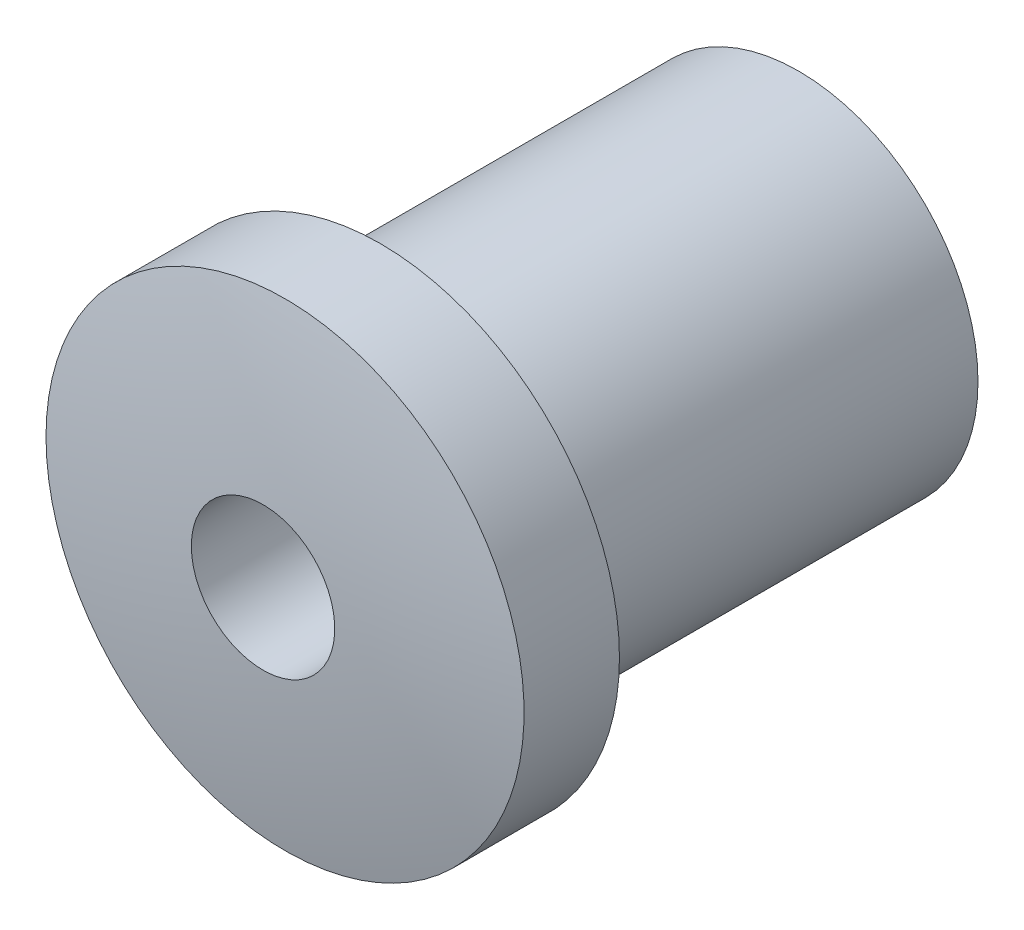
from build123d import *

# Parameters (mm, degrees)
SKETCH1_R                    = 15
BOSS_EXTRUDE1_DEPTH          = 35
CUT_EXTRUDE1_DEPTH           = 12
F_12_5_12_5_DIAMETER_HOLE1_D = 12.5
SKETCH10_R                   = 20
SKETCH10_R_2                 = 6
BOSS_EXTRUDE2_DEPTH          = 10


with BuildPart() as part:
    # Sketch1 → Boss-Extrude1 (new body)
    with BuildSketch(Plane.XY):
        Circle(SKETCH1_R)
    extrude(amount=BOSS_EXTRUDE1_DEPTH)

    # Sketch5 → Cut-Extrude1 (cut)
    with BuildSketch(Plane(origin=(0, 0, 0), x_dir=(-1, 0, 0), z_dir=(0, 0, -1))):
        Polygon((11.027390142, 0), (5.513695071, 9.55), (-5.513695071, 9.55), (-11.027390142, 0), (-5.513695071, -9.55), (5.513695071, -9.55), align=None)
    extrude(amount=-CUT_EXTRUDE1_DEPTH, mode=Mode.SUBTRACT)

    # Ø12.5 (12.5) Diameter Hole1 (through all)
    with Locations(Plane(origin=(0, 0, 12), x_dir=(-1, 0, 0), z_dir=(0, 0, -1))):
        with Locations((0, 0)):
            Hole(F_12_5_12_5_DIAMETER_HOLE1_D / 2)

    # Sketch10 → Boss-Extrude2 (add)
    with BuildSketch(Plane.XY.offset(35)):
        Circle(SKETCH10_R)
        Circle(SKETCH10_R_2, mode=Mode.SUBTRACT)
    extrude(amount=BOSS_EXTRUDE2_DEPTH)

    # Sketch11 → Cut-Revolve6 (revolve, cut)
    with BuildSketch(Plane(origin=(0, 0, 0), x_dir=(1, 0, 0), z_dir=(0, 1, 0))):
        with BuildLine():
            Line((-20, -42.979589711), (-20, -45))
            Line((-20, -45), (-6, -45))
            Line((-6, -45), (-6, -44.819837708))
            ThreePointArc((-6, -44.819837708), (-13.032521942, -44.147129922), (-20, -42.979589711))
        make_face()
    revolve(axis=Axis((0, 0, 0), (0, 0, 1)), mode=Mode.SUBTRACT)


solid = part.part
